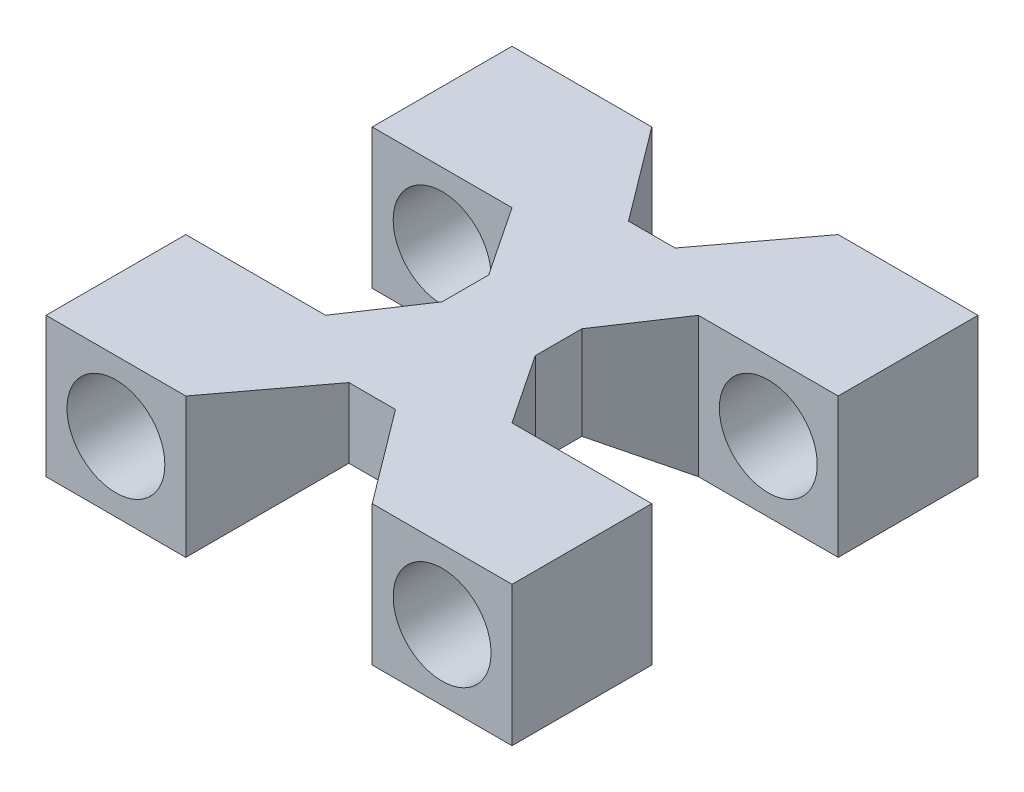
from build123d import *

# Parameters (mm, degrees)
EXTRUDE_2_DEPTH          = 30
SKETCH_3_R               = 10.5
CUT_EXTRUDE_1_DEPTH      = 30
CUT_EXTRUDE_START        = -30
SKETCH_4_R               = 10.5
CUT_EXTRUDE_2_DEPTH      = 30
SKETCH_5_R               = 10.5
CUT_EXTRUDE_3_DEPTH      = 30
SKETCH_6_R               = 10.5
CUT_EXTRUDE_4_DEPTH      = 30
CUT_EXTRUDE_5_DEPTH      = 99.994949366
CUT_EXTRUDE_5_DEPTH_BACK = 99.994949366


with BuildPart() as part:
    # Эскиз2 → Бобышка-Вытянуть2 (new body)
    with BuildSketch(Plane(origin=(0, 0, 0), x_dir=(1, 0, 0), z_dir=(0, 1, 0))):
        Polygon((-20, 50), (-50, 50), (-50, 20), (-20, 20), (-10, 5), (-10, -5), (-20, -20), (-50, -20), (-50, -50), (-20, -50), (-5, -30), (5, -30), (20, -50), (50, -50), (50, -20), (20, -20), (10, -5), (10, 5), (20, 20), (50, 20), (50, 50), (20, 50), (5, 30), (-5, 30), align=None)
    extrude(amount=EXTRUDE_2_DEPTH)

    # Эскиз3 → Вырез-Вытянуть1 (cut)
    with BuildSketch(Plane.XY.offset(50)):
        with Locations((-35, 15)):
            Circle(SKETCH_3_R)
    extrude(amount=-CUT_EXTRUDE_1_DEPTH, mode=Mode.SUBTRACT)

    # Эскиз4 → Вырез-Вытянуть2 (cut)
    with BuildSketch(Plane(origin=(0, 0, -50), x_dir=(-1, 0, 0), z_dir=(0, 0, -1)).offset(CUT_EXTRUDE_START)):
        with Locations(Location((35, 15, 0), (0, 0, 180))):
            Circle(SKETCH_4_R)
    extrude(amount=CUT_EXTRUDE_2_DEPTH, mode=Mode.SUBTRACT)

    # Эскиз5 → Вырез-Вытянуть3 (cut)
    with BuildSketch(Plane(origin=(0, 0, -50), x_dir=(-1, 0, 0), z_dir=(0, 0, -1))):
        with Locations((-35, 15)):
            Circle(SKETCH_5_R)
    extrude(amount=-CUT_EXTRUDE_3_DEPTH, mode=Mode.SUBTRACT)

    # Эскиз6 → Вырез-Вытянуть4 (cut)
    with BuildSketch(Plane.XY.offset(50).offset(CUT_EXTRUDE_START)):
        with Locations(Location((35, 15, 0), (0, 0, 180))):
            Circle(SKETCH_6_R)
    extrude(amount=CUT_EXTRUDE_4_DEPTH, mode=Mode.SUBTRACT)

    # Эскиз7 → Вырез-Вытянуть5 (cut, two sides: drawn at the far end of the back side and taken through both)
    with BuildSketch(Plane.XY.offset(30).offset(-CUT_EXTRUDE_5_DEPTH_BACK)):
        Polygon((-20, 0), (-5, 15), (5, 15), (20, 0), align=None)
    extrude(amount=CUT_EXTRUDE_5_DEPTH + CUT_EXTRUDE_5_DEPTH_BACK, mode=Mode.SUBTRACT)


solid = part.part
